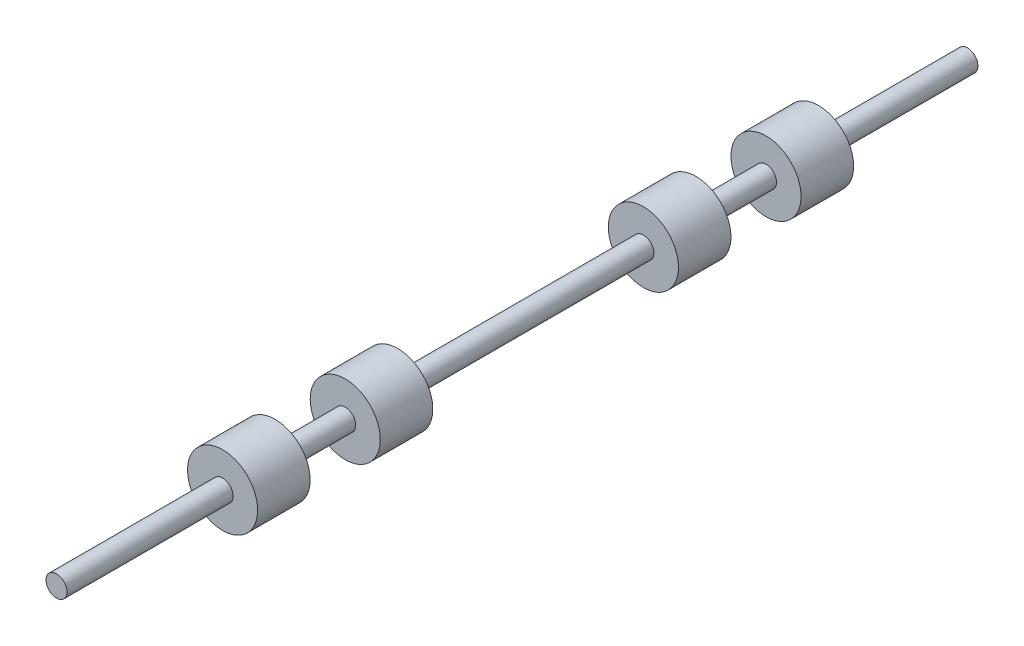
from build123d import *

# Parameters (mm, degrees)
SKETCH1_R           = 7.62
BOSS_EXTRUDE1_DEPTH = 660.4
SKETCH2_W           = 25.4
SKETCH2_H           = 38.1


with BuildPart() as part:
    # Sketch1 → Boss-Extrude1 (new body)
    with BuildSketch(Plane.XY):
        Circle(SKETCH1_R)
    extrude(amount=BOSS_EXTRUDE1_DEPTH)

    # Sketch2 → Revolve1 (revolve)
    with BuildSketch(Plane(origin=(0, 0, 0), x_dir=(1, 0, 0), z_dir=(0, 1, 0)), mode=Mode.PRIVATE) as revolve1_sk:
        with Locations((12.7, -127)):
            Rectangle(SKETCH2_W, SKETCH2_H)
        with Locations((12.7, -215.9)):
            Rectangle(SKETCH2_W, SKETCH2_H)
        with Locations((12.7, -432.054)):
            Rectangle(SKETCH2_W, SKETCH2_H)
        with Locations((12.7, -520.954)):
            Rectangle(SKETCH2_W, SKETCH2_H)
    revolve(revolve1_sk.sketch.rotate(Axis((0, 0, 0), (0, 0, 1)), 180), axis=Axis((0, 0, 0), (0, 0, 1)))


solid = part.part
